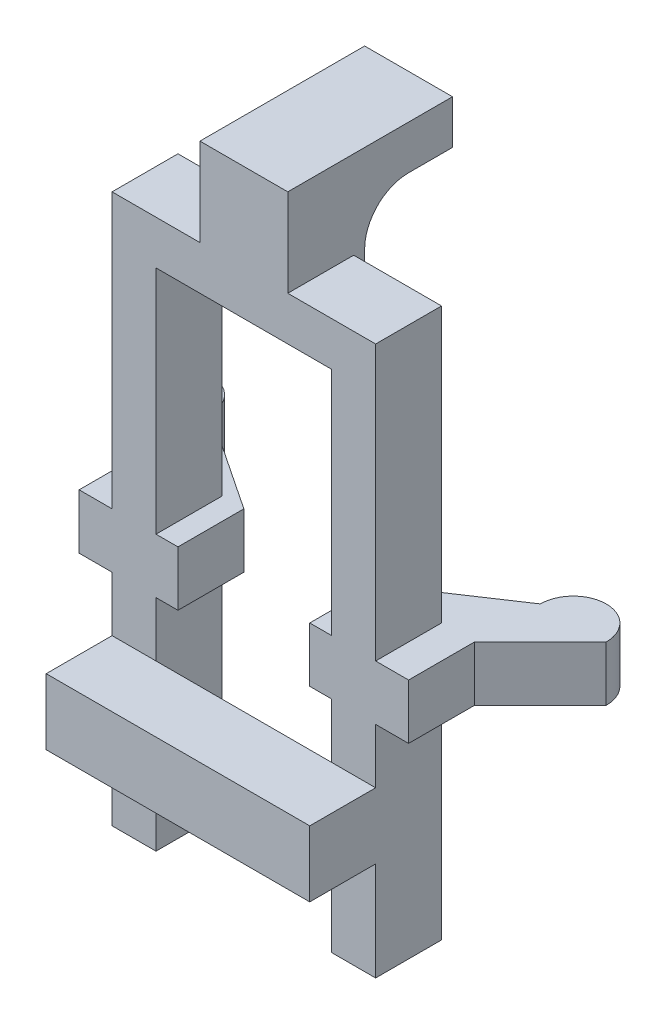
from build123d import *

# Parameters (mm, degrees)
BOSS_EXTRUDE1_DEPTH = 30
BOSS_EXTRUDE2_DEPTH = 25
BOSS_EXTRUDE8_REACH = 304.903
SKETCH5_W           = 30
SKETCH5_H           = 30
BOSS_EXTRUDE9_DEPTH = 20


with BuildPart() as part:
    # Sketch1 → Boss-Extrude1 (new body)
    with BuildSketch(Plane.XY):
        Polygon((-60, 0), (-40, 0), (-40, 230), (40, 230), (40, 0), (60, 0), (60, 250), (-60, 250), align=None)
    extrude(amount=BOSS_EXTRUDE1_DEPTH)

    # Sketch4 → Boss-Extrude2 (add)
    with BuildSketch(Plane(origin=(0, 100, 0), x_dir=(-1, 0, 0), z_dir=(0, -1, 0))):
        with BuildLine():
            Line((-60, -30), (-75, -30))
            Line((-75, -30), (-75, 0))
            Line((-75, 0), (-105, 30))
            ThreePointArc((-105, 30), (-90, 45), (-75, 30))
            Line((-75, 30), (-30, 0))
            Line((-30, 0), (-30, -30))
            Line((-30, -30), (-60, -30))
        make_face()
    boss_extrude2 = extrude(amount=-BOSS_EXTRUDE2_DEPTH)

    # Mirror1: Boss-Extrude2 across plane
    add(boss_extrude2.mirror(Plane(origin=(0, 0, 0), x_dir=(0, 0, 1), z_dir=(1, 0, 0))))

    # Boss-Extrude8: up to this face of the body (flat: up to its plane)
    boss_extrude8_end = Plane(part.part.faces().sort_by_distance((60, 50, 15))[0])
    # Sketch5 → Boss-Extrude8 (add, up to the picked face)
    with BuildSketch(Plane.ZY.offset(60), mode=Mode.PRIVATE) as boss_extrude8_sk1:
        with Locations((45, 60)):
            Rectangle(SKETCH5_W, SKETCH5_H)
    boss_extrude8_tool1 = split(extrude(boss_extrude8_sk1.sketch, amount=-BOSS_EXTRUDE8_REACH, mode=Mode.PRIVATE), bisect_by=boss_extrude8_end, keep=Keep.BOTH, mode=Mode.PRIVATE)
    add(boss_extrude8_tool1.solids().sort_by(Axis((-60, 60, 45), (1, 0, 0)))[0])

    # Sketch6 → Boss-Extrude9 (add, symmetric)
    with BuildSketch(Plane(origin=(0, 0, 0), x_dir=(0, 0, -1), z_dir=(1, 0, 0))):
        with BuildLine():
            Line((-30, 230), (5, 230))
            Line((5, 230), (5, 250))
            ThreePointArc((5, 250), (10.857864376, 264.142135624), (25, 270))
            Line((25, 270), (45, 270))
            Line((45, 270), (45, 290))
            Line((45, 290), (-30, 290))
            Line((-30, 290), (-30, 230))
        make_face()
    extrude(amount=BOSS_EXTRUDE9_DEPTH, both=True)


solid = part.part
